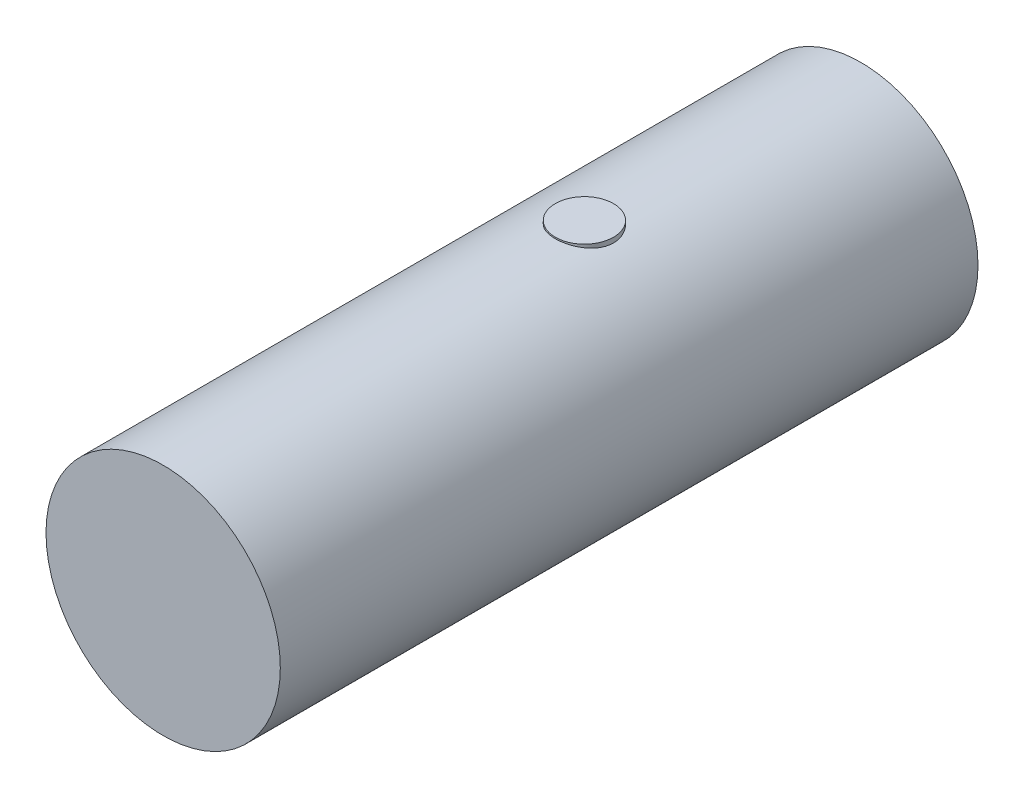
from build123d import *

# Parameters (mm, degrees)
SKIZZE1_R                            = 89
AUFSATZ_LINEAR_AUSTRAGEN1_DEPTH      = 530
AUFSATZ_LINEAR_AUSTRAGEN2_DEPTH      = 90
AUFSATZ_LINEAR_AUSTRAGEN2_DEPTH_BACK = 90
SKIZZE2_R                            = 22.126613263


with BuildPart() as part:
    # Skizze1 → Aufsatz-Linear austragen1 (new body)
    with BuildSketch(Plane.XY):
        Circle(SKIZZE1_R)
    extrude(amount=AUFSATZ_LINEAR_AUSTRAGEN1_DEPTH)

    # Skizze2 → Aufsatz-Linear austragen2 (add, two sides: drawn at the far end of the back side and taken through both)
    with BuildSketch(Plane(origin=(0, 0, 0), x_dir=(1, 0, 0), z_dir=(0, 1, 0)).offset(-AUFSATZ_LINEAR_AUSTRAGEN2_DEPTH_BACK)):
        with Locations((0, -210)):
            Circle(SKIZZE2_R)
    extrude(amount=AUFSATZ_LINEAR_AUSTRAGEN2_DEPTH + AUFSATZ_LINEAR_AUSTRAGEN2_DEPTH_BACK)


solid = part.part
